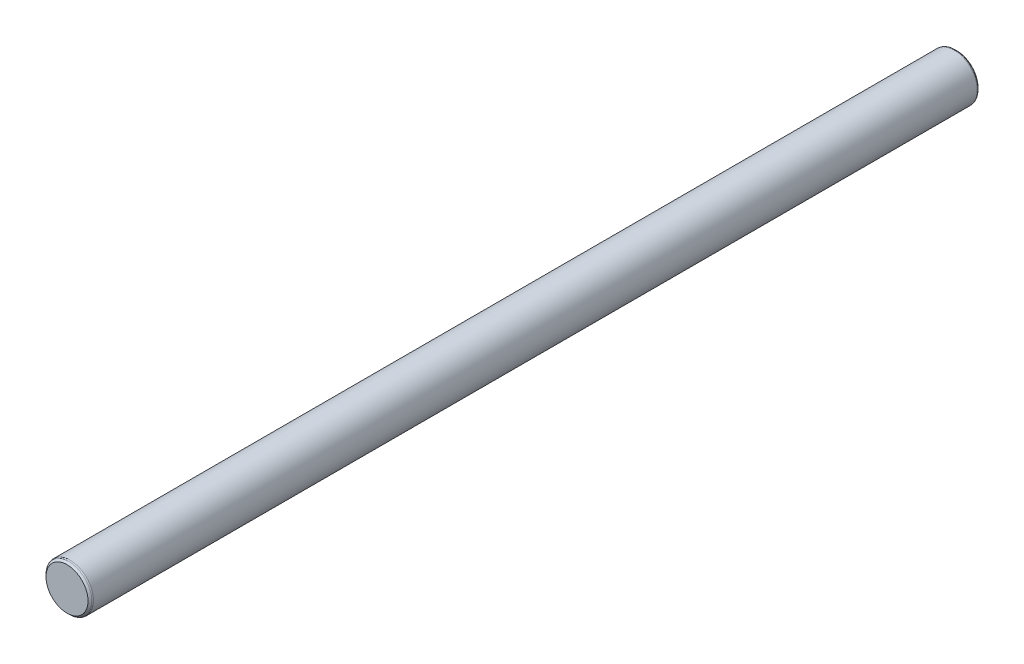
from build123d import *

# Parameters (mm, degrees)
SKETCH3_R           = 3
BOSS_EXTRUDE1_DEPTH = 57.15
CHAMFER1_SIZE       = 0.3
FILLET2_R           = 0.225


with BuildPart() as part:
    # Sketch3 → Boss-Extrude1 (new, symmetric)
    with BuildSketch(Plane.XY):
        Circle(SKETCH3_R)
    extrude(amount=BOSS_EXTRUDE1_DEPTH, both=True)

    # Chamfer1
    chamfer1_edges = [part.edges().sort_by_distance(p)[0] for p in [
        (-3, 0, -57.15),
        (-3, 0, 57.15),
    ]]
    chamfer(chamfer1_edges, length=CHAMFER1_SIZE)

    # Fillet2
    fillet2_edges = [part.edges().sort_by_distance(p)[0] for p in [
        (-3, 0, -56.85),
        (-3, 0, 56.85),
    ]]
    fillet(fillet2_edges, radius=FILLET2_R)


solid = part.part
